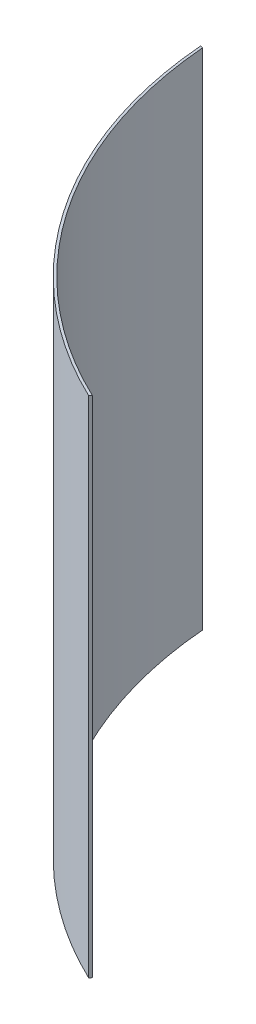
from build123d import *

# Parameters (mm, degrees)
BOSS_EXTRUDE1_DEPTH = 2025.87


with BuildPart() as part:
    # Sketch1 → Boss-Extrude1 (new body)
    with BuildSketch(Plane(origin=(0, 0, 0), x_dir=(1, 0, 0), z_dir=(0, 1, 0))):
        with BuildLine():
            Line((-746.1680939, -1571.888636527), (-752.264088777, -1580.062891386))
            ThreePointArc((-752.264088777, -1580.062891386), (-1441.511256929, -992.242559129), (-1744.506647906, -138.551634457))
            Line((-1744.506647906, -138.551634457), (-1734.354708295, -140.05161838))
            ThreePointArc((-1734.354708295, -140.05161838), (-1432.05714086, -988.338532746), (-746.1680939, -1571.888636527))
        make_face()
    extrude(amount=BOSS_EXTRUDE1_DEPTH)


solid = part.part
